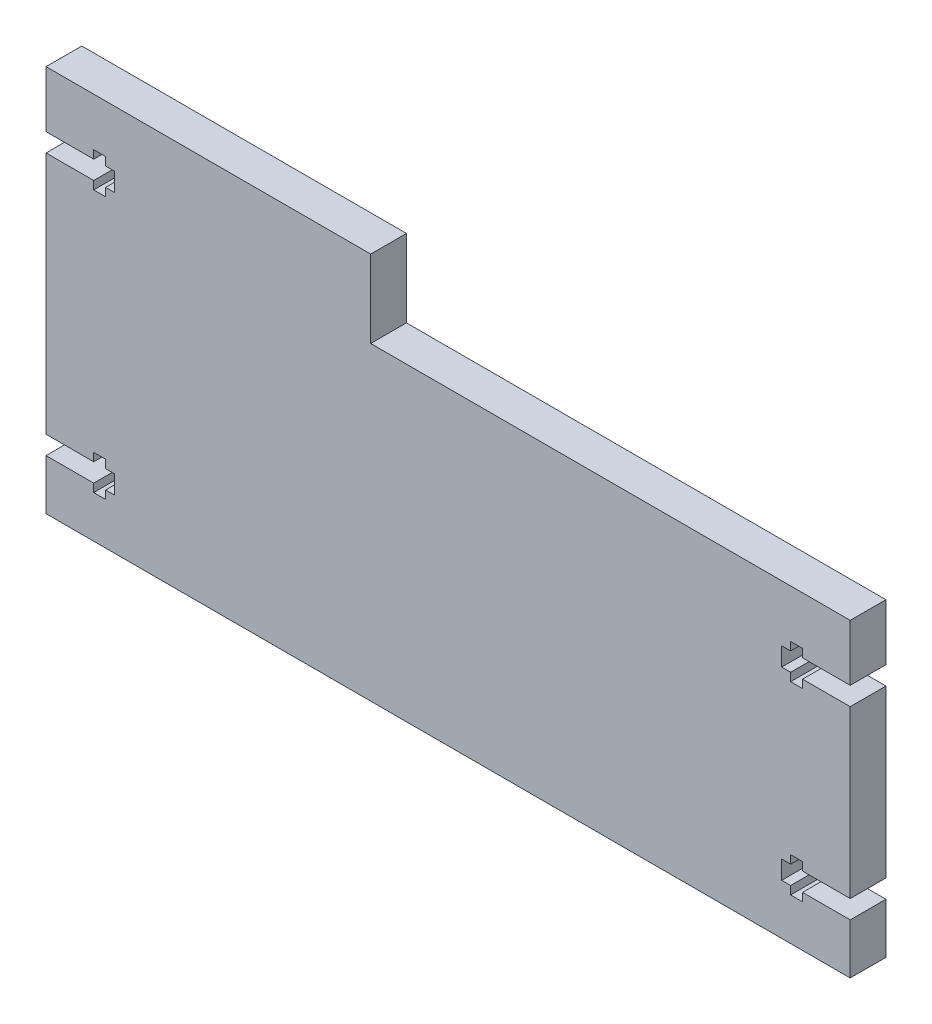
from build123d import *

# Parameters (mm, degrees)
SZKIC1_W                    = 135
SZKIC1_H                    = 65
DODANIE_WYCI_GNI_CIE1_DEPTH = 6
WYTNIJ_WYCI_GNI_CIE1_DEPTH  = 6
SZYK_LINIOWY1_COUNT         = 2
SZYK_LINIOWY1_PITCH         = 44
SZYK_LINIOWY2_COUNT         = 2
SZYK_LINIOWY2_PITCH         = 31
SZYK_LINIOWY2_COPY_1_DEPTH  = 6
SZKIC3_W                    = 15.645494432
SZKIC3_H                    = 9.425
DODANIE_WYCI_GNI_CIE2_DEPTH = 6
SZKIC4_W                    = 80.5
SZKIC4_H                    = 13
WYTNIJ_WYCI_GNI_CIE2_DEPTH  = 6


with BuildPart() as part:
    # Szkic1 → Dodanie-wyciągnięcie1 (new body)
    with BuildSketch(Plane.XY):
        with Locations((430.631728381, 262.255356576)):
            Rectangle(SZKIC1_W, SZKIC1_H)
    extrude(amount=DODANIE_WYCI_GNI_CIE1_DEPTH)

    # Szkic2 → Wytnij-wyciągnięcie1 (cut)
    with BuildSketch(Plane.XY.offset(6)):
        Polygon((363.131728381, 241.305356576), (363.131728381, 238.205356576), (371.131728381, 238.205356576), (371.131728381, 236.830356576), (373.131728381, 236.830356576), (373.131728381, 238.205356576), (374.631728381, 238.205356576), (374.631728381, 241.305356576), (373.131728381, 241.305356576), (373.131728381, 242.680356576), (371.131728381, 242.680356576), (371.131728381, 241.305356576), align=None)
    wytnij_wyci_gni_cie1 = extrude(amount=-WYTNIJ_WYCI_GNI_CIE1_DEPTH, mode=Mode.SUBTRACT)

    # Szyk liniowy1: Wytnij-wyciągnięcie1 ×2
    with Locations(*[(0, i * SZYK_LINIOWY1_PITCH, 0) for i in range(1, SZYK_LINIOWY1_COUNT)]):
        add(wytnij_wyci_gni_cie1, mode=Mode.SUBTRACT)

    # Lustro1: Wytnij-wyciągnięcie1 across plane
    add(wytnij_wyci_gni_cie1.mirror(Plane.ZY.offset(-430.631728381)), mode=Mode.SUBTRACT)

    # Szyk liniowy2: Wytnij-wyciągnięcie1 ×2
    with Locations(*[(0, i * SZYK_LINIOWY2_PITCH, 0) for i in range(1, SZYK_LINIOWY2_COUNT)]):
        add(wytnij_wyci_gni_cie1, mode=Mode.SUBTRACT)

    # Szyk liniowy2 copy 1 sketch → Szyk liniowy2 copy 1 (cut)
    with BuildSketch(Plane(origin=(861.263456762, 31, 6), x_dir=(-1, 0, 0), z_dir=(0, 0, 1))):
        Polygon((363.131728381, -241.305356576), (363.131728381, -238.205356576), (371.131728381, -238.205356576), (371.131728381, -236.830356576), (373.131728381, -236.830356576), (373.131728381, -238.205356576), (374.631728381, -238.205356576), (374.631728381, -241.305356576), (373.131728381, -241.305356576), (373.131728381, -242.680356576), (371.131728381, -242.680356576), (371.131728381, -241.305356576), align=None)
    extrude(amount=-SZYK_LINIOWY2_COPY_1_DEPTH, mode=Mode.SUBTRACT)

    # Szkic3 → Dodanie-wyciągnięcie2 (add)
    with BuildSketch(Plane.XY.offset(6)):
        with Locations((370.954475597, 272.542856576)):
            Rectangle(SZKIC3_W, SZKIC3_H)
    extrude(amount=-DODANIE_WYCI_GNI_CIE2_DEPTH)

    # Szkic4 → Wytnij-wyciągnięcie2 (cut)
    with BuildSketch(Plane.XY.offset(6)):
        with Locations((457.881728381, 288.255356576)):
            Rectangle(SZKIC4_W, SZKIC4_H)
    extrude(amount=-WYTNIJ_WYCI_GNI_CIE2_DEPTH, mode=Mode.SUBTRACT)


solid = part.part
